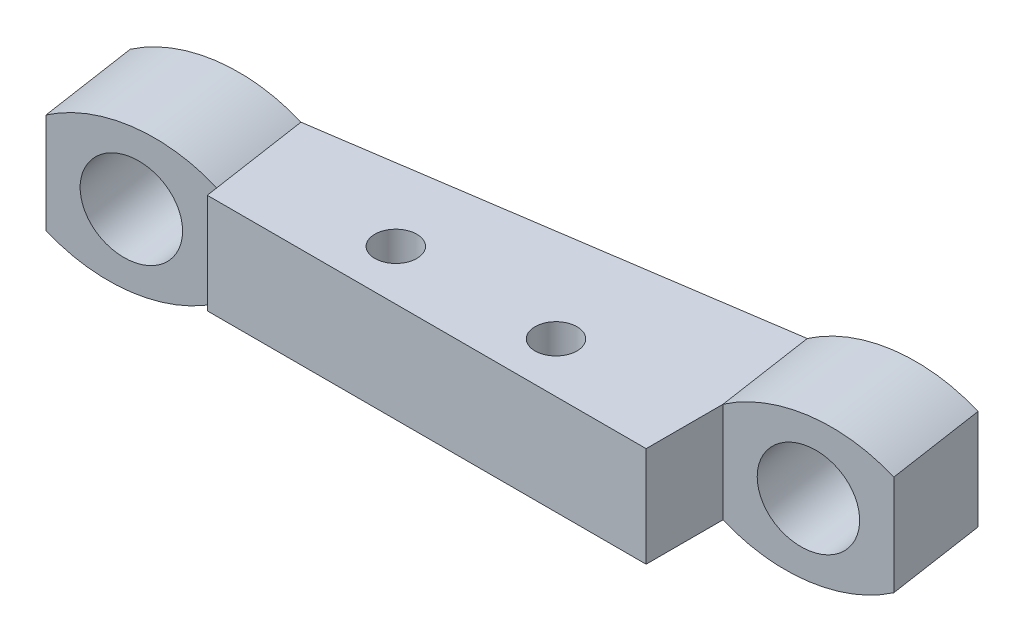
from build123d import *

# Parameters (mm, degrees)
EXTRUDE_2_DEPTH     = 5
SKETCH_4_R          = 4.5
EXTRUDE_3_DEPTH     = 10
EXTRUDE_4_DEPTH     = 5
CUT_EXTRUDE_1_DEPTH = 5
EXTRUDE_5_DEPTH     = 5
CUT_EXTRUDE_2_DEPTH = 5
SKETCH_9_R          = 2.1
CUT_EXTRUDE_3_DEPTH = 5


with BuildPart() as part:
    # 草图3 → 凸台-拉伸2 (new, symmetric)
    with BuildSketch(Plane(origin=(0, 0, 0), x_dir=(1, 0, 0), z_dir=(0, 1, 0))):
        Polygon((-22, 0), (-22, 11), (22, 17.575844059), (22, 0), align=None)
    extrude(amount=EXTRUDE_2_DEPTH, both=True)

    # 草图4 → 凸台-拉伸3 (add)
    # profile 1 of 2: a face of its own
    with BuildSketch(Plane(origin=(-2.08869206, 0, -13.97576491), x_dir=(-0.9890158633619178, 0, 0.1478094111296043), z_dir=(-0.1478094111296043, 0, -0.9890158633619178))):
        with BuildLine():
            Line((-24.356224154, -5), (-24.356224154, 5))
            ThreePointArc((-24.356224154, 5), (-31.856224154, 7.178409582), (-39.356224154, 5))
            Line((-39.356224154, 5), (-39.356224154, -5))
            ThreePointArc((-39.356224154, -5), (-31.856224154, -7.178409582), (-24.356224154, -5))
        make_face()
        with Locations((-31.856224154, 0)):
            Circle(SKETCH_4_R, mode=Mode.SUBTRACT)
    # profile 2 of 2: a face of its own
    with BuildSketch(Plane(origin=(-2.08869206, 0, -13.97576491), x_dir=(-0.9890158633619178, 0, 0.1478094111296043), z_dir=(-0.1478094111296043, 0, -0.9890158633619178))):
        with BuildLine():
            Line((35.132445472, 5), (35.132445472, -5))
            ThreePointArc((35.132445472, -5), (27.632445472, -7.178409582), (20.132445472, -5))
            Line((20.132445472, -5), (20.132445472, 5))
            ThreePointArc((20.132445472, 5), (27.632445472, 7.178409582), (35.132445472, 5))
        make_face()
        with Locations(Location((27.632445472, 0, 0), (0, 0, 180))):
            Circle(SKETCH_4_R, mode=Mode.SUBTRACT)
    extrude(amount=-EXTRUDE_3_DEPTH)


with BuildPart() as extrude_3_piece_1:
    # of the separate pieces the step leaves, piece 1, a body of its own (extrude_3_pieces)
    add(part.part.solids().sort_by_distance((-22, -5, 0))[0])



with BuildPart() as extrude_3_piece_2:
    # of the separate pieces the step leaves, piece 2, a body of its own (extrude_3_pieces)
    add(part.part.solids().sort_by_distance((23.478094111, -5, -7.685685426))[0])


with BuildPart() as extrude_3_piece_1_1:
    add(extrude_3_piece_1.part)

    add(extrude_3_piece_2.part)  # 凸台-拉伸4 merges 凸台-拉伸3 piece 2
    # 草图5 → 凸台-拉伸4 (add, symmetric)
    with BuildSketch(Plane(origin=(0, 0, 0), x_dir=(1, 0, 0), z_dir=(0, 1, 0))):
        Polygon((23.478094111, 7.685685426), (22, 7.464782781), (22, 17.575844059), align=None)
    extrude(amount=EXTRUDE_4_DEPTH, both=True)

    # 草图6 → 切除-拉伸1 (cut, symmetric)
    with BuildSketch(Plane(origin=(0, 0, 0), x_dir=(1, 0, 0), z_dir=(0, 1, 0))):
        Polygon((-22, 0), (-22, 0.888938721), (-20.521905889, 1.109841366), (-20.356038985, 0), align=None)
    extrude(amount=CUT_EXTRUDE_1_DEPTH, both=True, mode=Mode.SUBTRACT)

    # 草图7 → 凸台-拉伸5 (add, symmetric)
    with BuildSketch(Plane(origin=(0, 0, 0), x_dir=(1, 0, 0), z_dir=(0, 1, 0))):
        Polygon((22, 0), (24.626727494, 0), (23.478094111, 7.685685426), (22, 7.464782781), align=None)
    extrude(amount=EXTRUDE_5_DEPTH, both=True)

    # 草图8 → 切除-拉伸2 (cut, symmetric)
    with BuildSketch(Plane(origin=(0, 0, 0), x_dir=(1, 0, 0), z_dir=(0, 1, 0))):
        Polygon((23.478094111, 0), (23.478094111, 7.685685426), (24.626727494, 0), align=None)
    extrude(amount=CUT_EXTRUDE_2_DEPTH, both=True, mode=Mode.SUBTRACT)

    # 草图9 → 切除-拉伸3 (cut, symmetric)
    with BuildSketch(Plane(origin=(0, 0, 0), x_dir=(1, 0, 0), z_dir=(0, 1, 0))):
        with Locations(Location((9.478094111, 5, 0), (0, 0, 270))):
            Circle(SKETCH_9_R)
        with Locations(Location((-6.521905889, 5, 0), (0, 0, 270))):
            Circle(SKETCH_9_R)
    extrude(amount=CUT_EXTRUDE_3_DEPTH, both=True, mode=Mode.SUBTRACT)


solid = extrude_3_piece_1_1.part
